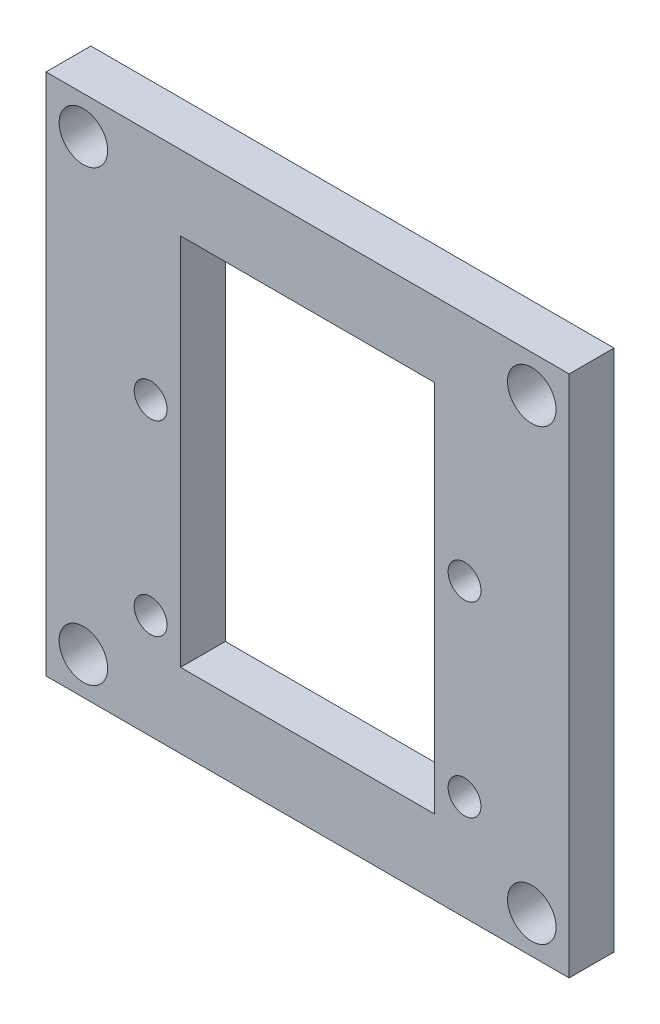
from build123d import *

# Parameters (mm, degrees)
SKETCH1_W           = 35
SKETCH1_H           = 35
SKETCH1_W_2         = 17
SKETCH1_H_2         = 25
SKETCH1_R           = 1.1
SKETCH1_R_2         = 1.624281561
BOSS_EXTRUDE1_DEPTH = 3


with BuildPart() as part:
    # Sketch1 → Boss-Extrude1 (new body)
    with BuildSketch(Plane.XY):
        with Locations((12.5, 12.5)):
            Rectangle(SKETCH1_W, SKETCH1_H)
        with Locations((12.5, 12.5)):
            Rectangle(SKETCH1_W_2, SKETCH1_H_2, mode=Mode.SUBTRACT)
        with Locations((2, 2)):
            Circle(SKETCH1_R, mode=Mode.SUBTRACT)
        with Locations((2, 14.5)):
            Circle(SKETCH1_R, mode=Mode.SUBTRACT)
        with Locations((-2.5, -2.5)):
            Circle(SKETCH1_R_2, mode=Mode.SUBTRACT)
        with Locations((27.5, -2.5)):
            Circle(SKETCH1_R_2, mode=Mode.SUBTRACT)
        with Locations((-2.5, 27.5)):
            Circle(SKETCH1_R_2, mode=Mode.SUBTRACT)
        with Locations((27.5, 27.5)):
            Circle(SKETCH1_R_2, mode=Mode.SUBTRACT)
        with Locations((23, 14.5)):
            Circle(SKETCH1_R, mode=Mode.SUBTRACT)
        with Locations((23, 2)):
            Circle(SKETCH1_R, mode=Mode.SUBTRACT)
    extrude(amount=BOSS_EXTRUDE1_DEPTH)


solid = part.part
